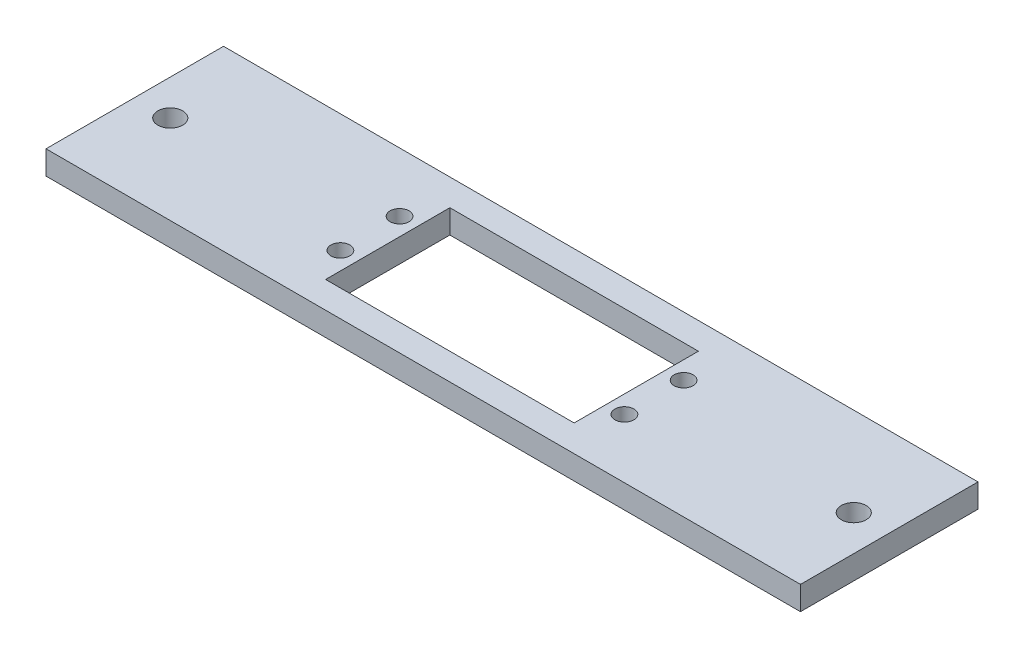
from build123d import *

# Parameters (mm, degrees)
SKETCH1_W           = 127.5
SKETCH1_H           = 30
SKETCH1_R           = 2.1
SKETCH1_W_2         = 42
SKETCH1_H_2         = 21
BOSS_EXTRUDE1_DEPTH = 4
SKETCH2_R           = 1.6
CUT_EXTRUDE1_DEPTH  = 66.612975089


with BuildPart() as part:
    # Sketch1 → Boss-Extrude1 (new body)
    with BuildSketch(Plane(origin=(0, 0, 0), x_dir=(1, 0, 0), z_dir=(0, 1, 0))):
        Rectangle(SKETCH1_W, SKETCH1_H)
        with Locations(Location((-57.75, 0, 0), (0, 0, 270))):
            Circle(SKETCH1_R, mode=Mode.SUBTRACT)
        with Locations(Location((57.75, 0, 0), (0, 0, 90))):
            Circle(SKETCH1_R, mode=Mode.SUBTRACT)
        Rectangle(SKETCH1_W_2, SKETCH1_H_2, mode=Mode.SUBTRACT)
    extrude(amount=BOSS_EXTRUDE1_DEPTH)

    # Sketch2 → Cut-Extrude1 (cut, through all)
    with BuildSketch(Plane(origin=(0, 4, 0), x_dir=(1, 0, 0), z_dir=(0, 1, 0))):
        with Locations(Location((-24, 5, 0), (0, 0, 270))):
            Circle(SKETCH2_R)
        with Locations(Location((-24, -5, 0), (0, 0, 90))):
            Circle(SKETCH2_R)
        with Locations(Location((24, -5, 0), (0, 0, 270))):
            Circle(SKETCH2_R)
        with Locations(Location((24, 5, 0), (0, 0, 90))):
            Circle(SKETCH2_R)
    extrude(amount=-CUT_EXTRUDE1_DEPTH, mode=Mode.SUBTRACT)


solid = part.part
